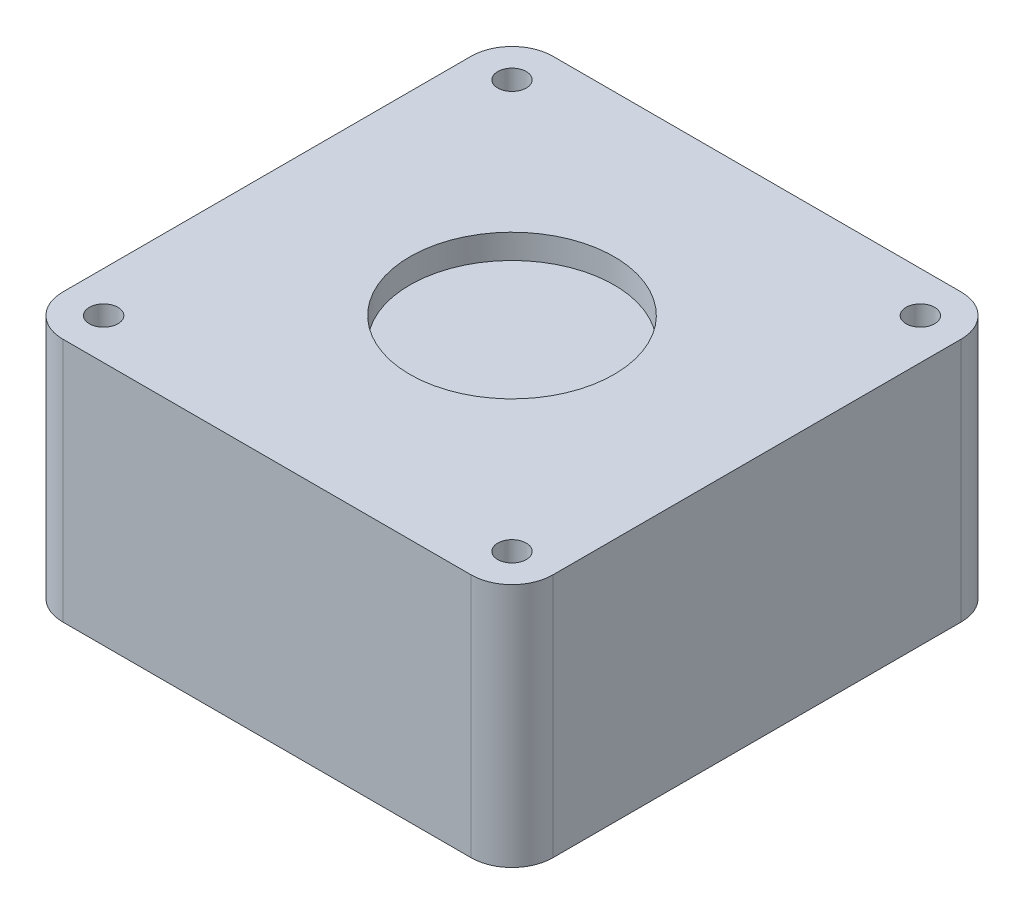
from build123d import *

# Parameters (mm, degrees)
SKETCH_1_W          = 60
SKETCH_1_H          = 60
EXTRUDE_1_DEPTH     = 30
SKETCH_2_R          = 1.75
CUT_EXTRUDE_1_DEPTH = 30
SKETCH_3_R          = 12.5
CUT_EXTRUDE_2_DEPTH = 3
SKETCH_4_W          = 20
SKETCH_4_H          = 20
CUT_EXTRUDE_3_DEPTH = 3
FILLET_1_R          = 5


with BuildPart() as part:
    # 草图1 → 凸台-拉伸1 (new body)
    with BuildSketch(Plane(origin=(0, 0, 0), x_dir=(1, 0, 0), z_dir=(0, 1, 0))):
        Rectangle(SKETCH_1_W, SKETCH_1_H)
    extrude(amount=EXTRUDE_1_DEPTH)

    # 草图2 → 切除-拉伸1 (cut)
    with BuildSketch(Plane(origin=(0, 30, 0), x_dir=(1, 0, 0), z_dir=(0, 1, 0))):
        with Locations(Location((25, 25, 0), (0, 0, 270))):
            Circle(SKETCH_2_R)
        with Locations(Location((-25, 25, 0), (0, 0, 270))):
            Circle(SKETCH_2_R)
        with Locations(Location((-25, -25, 0), (0, 0, 270))):
            Circle(SKETCH_2_R)
        with Locations(Location((25, -25, 0), (0, 0, 270))):
            Circle(SKETCH_2_R)
    extrude(amount=-CUT_EXTRUDE_1_DEPTH, mode=Mode.SUBTRACT)

    # 草图3 → 切除-拉伸2 (cut)
    with BuildSketch(Plane(origin=(0, 30, 0), x_dir=(1, 0, 0), z_dir=(0, 1, 0))):
        with Locations(Location((0, 0, 0), (0, 0, 270))):
            Circle(SKETCH_3_R)
    extrude(amount=-CUT_EXTRUDE_2_DEPTH, mode=Mode.SUBTRACT)

    # 草图4 → 切除-拉伸3 (cut)
    with BuildSketch(Plane.XZ):
        Rectangle(SKETCH_4_W, SKETCH_4_H)
    extrude(amount=-CUT_EXTRUDE_3_DEPTH, mode=Mode.SUBTRACT)

    # 圆角1
    fillet_1_edges = [part.edges().sort_by_distance(p)[0] for p in [
        (30, 15, 30),
        (-30, 15, 30),
        (-30, 15, -30),
        (30, 15, -30),
    ]]
    fillet(fillet_1_edges, radius=FILLET_1_R)


solid = part.part
